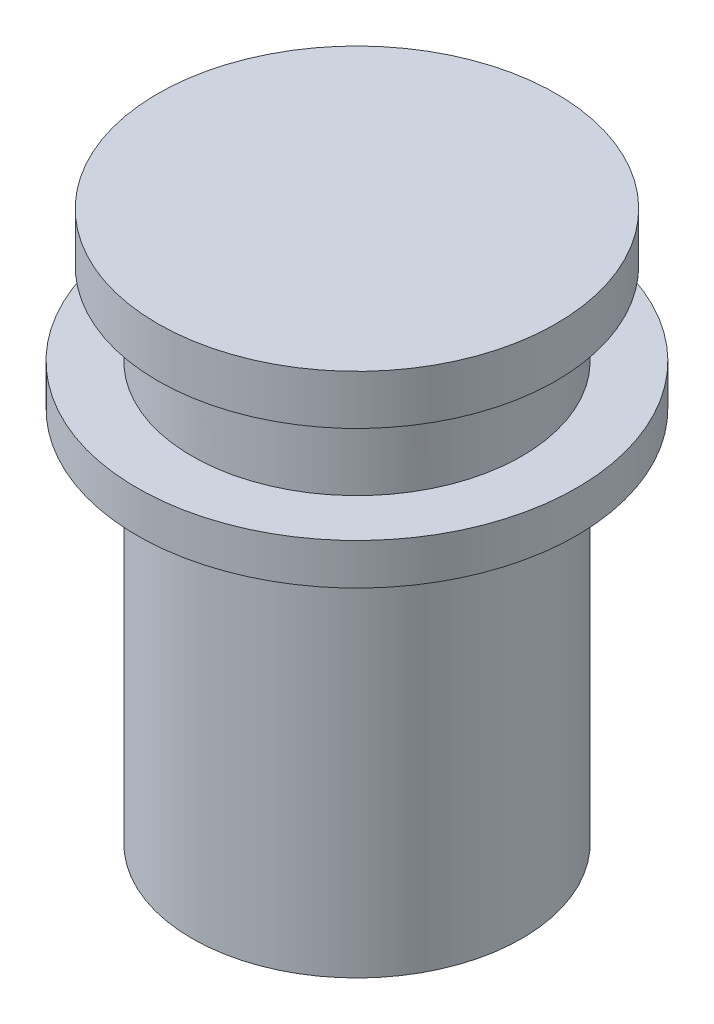
from build123d import *

# Parameters (mm, degrees)
SKETCH_1_R      = 6
EXTRUDE_1_DEPTH = 18.2
SKETCH_2_R      = 7.25
EXTRUDE_2_DEPTH = 1.8
SKETCH_3_W      = 2
SKETCH_3_H      = 1.5


with BuildPart() as part:
    # 草图1 → 凸台-拉伸1 (new body)
    with BuildSketch(Plane(origin=(0, 0, 0), x_dir=(1, 0, 0), z_dir=(0, 1, 0))):
        with Locations(Location((0, 0, 0), (0, 0, 270))):
            Circle(SKETCH_1_R)
    extrude(amount=EXTRUDE_1_DEPTH)

    # 草图2 → 凸台-拉伸2 (add)
    with BuildSketch(Plane(origin=(0, 18.2, 0), x_dir=(1, 0, 0), z_dir=(0, 1, 0))):
        with Locations(Location((0, 0, 0), (0, 0, 270))):
            Circle(SKETCH_2_R)
    extrude(amount=EXTRUDE_2_DEPTH)

    # 草图3 → 旋转1 (revolve)
    with BuildSketch(Plane(origin=(0, 0, 0), x_dir=(0, 0, -1), z_dir=(1, 0, 0)), mode=Mode.PRIVATE) as revolve_1_sk:
        with Locations((-7, 14.45)):
            Rectangle(SKETCH_3_W, SKETCH_3_H)
    revolve(revolve_1_sk.sketch.rotate(Axis((0, 0, 0), (0, 1, 0)), 180), axis=Axis((0, 0, 0), (0, 1, 0)))


solid = part.part
